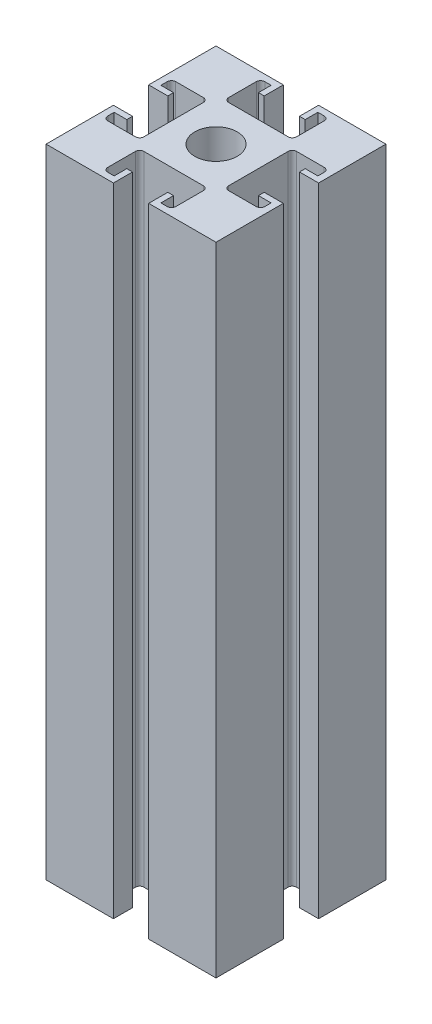
from build123d import *

# Parameters (mm, degrees)
RESSALTO_EXTRUS_O1_DEPTH = 150
ESBO_O2_3_R              = 5
CORTE_EXTRUS_O1_DEPTH    = 10
CORTE_EXTRUS_O2_START    = -20
ESBO_O4_R                = 5
CORTE_EXTRUS_O2_DEPTH    = 20


with BuildPart() as part:
    # Esboço2 → Ressalto-extrusão1 (new body)
    with BuildSketch(Plane(origin=(0, 0, 0), x_dir=(1, 0, 0), z_dir=(0, 1, 0))):
        with BuildLine():
            Line((-1.803730261, 22.417940287), (-1.803730261, 6.567940287))
            Line((-1.803730261, 6.567940287), (2.696269739, 6.567940287))
            Line((2.696269739, 6.567940287), (2.696269739, 7.917940287))
            Line((2.696269739, 7.917940287), (-0.281184469, 7.917940287))
            Line((-0.281184469, 7.917940287), (-0.281184469, 9.417940287))
            ThreePointArc((-0.281184469, 9.417940287), (0.01170875, 10.125047068), (0.718815531, 10.417940287))
            Line((0.718815531, 10.417940287), (7.218815531, 10.417940287))
            ThreePointArc((7.218815531, 10.417940287), (7.925922312, 10.125047068), (8.218815531, 9.417940287))
            Line((8.218815531, 9.417940287), (8.218815531, -4.582059713))
            ThreePointArc((8.218815531, -4.582059713), (7.925922312, -5.289166494), (7.218815531, -5.582059713))
            Line((7.218815531, -5.582059713), (0.718815531, -5.582059713))
            ThreePointArc((0.718815531, -5.582059713), (0.01170875, -5.289166494), (-0.281184469, -4.582059713))
            Line((-0.281184469, -4.582059713), (-0.281184469, -3.082059713))
            Line((-0.281184469, -3.082059713), (2.696269739, -3.082059713))
            Line((2.696269739, -3.082059713), (2.696269739, -1.732059713))
            Line((2.696269739, -1.732059713), (-1.803730261, -1.732059713))
            Line((-1.803730261, -1.732059713), (-1.803730261, -17.582059713))
            Line((-1.803730261, -17.582059713), (14.046269739, -17.582059713))
            Line((14.046269739, -17.582059713), (14.046269739, -13.082059713))
            Line((14.046269739, -13.082059713), (12.696269739, -13.082059713))
            Line((12.696269739, -13.082059713), (12.696269739, -16.059513921))
            Line((12.696269739, -16.059513921), (11.196269739, -16.059513921))
            ThreePointArc((11.196269739, -16.059513921), (10.489162958, -15.766620702), (10.196269739, -15.059513921))
            Line((10.196269739, -15.059513921), (10.196269739, -8.559513921))
            ThreePointArc((10.196269739, -8.559513921), (10.489162958, -7.85240714), (11.196269739, -7.559513921))
            Line((11.196269739, -7.559513921), (25.196269739, -7.559513921))
            ThreePointArc((25.196269739, -7.559513921), (25.90337652, -7.85240714), (26.196269739, -8.559513921))
            Line((26.196269739, -8.559513921), (26.196269739, -15.059513921))
            ThreePointArc((26.196269739, -15.059513921), (25.90337652, -15.766620702), (25.196269739, -16.059513921))
            Line((25.196269739, -16.059513921), (23.696269739, -16.059513921))
            Line((23.696269739, -16.059513921), (23.696269739, -13.082059713))
            Line((23.696269739, -13.082059713), (22.346269739, -13.082059713))
            Line((22.346269739, -13.082059713), (22.346269739, -17.582059713))
            Line((22.346269739, -17.582059713), (38.196269739, -17.582059713))
            Line((38.196269739, -17.582059713), (38.196269739, -1.732059713))
            Line((38.196269739, -1.732059713), (33.696269739, -1.732059713))
            Line((33.696269739, -1.732059713), (33.696269739, -3.082059713))
            Line((33.696269739, -3.082059713), (36.673723947, -3.082059713))
            Line((36.673723947, -3.082059713), (36.673723947, -4.582059713))
            ThreePointArc((36.673723947, -4.582059713), (36.380830728, -5.289166494), (35.673723947, -5.582059713))
            Line((35.673723947, -5.582059713), (29.173723947, -5.582059713))
            ThreePointArc((29.173723947, -5.582059713), (28.466617166, -5.289166494), (28.173723947, -4.582059713))
            Line((28.173723947, -4.582059713), (28.173723947, 9.417940287))
            ThreePointArc((28.173723947, 9.417940287), (28.466617166, 10.125047068), (29.173723947, 10.417940287))
            Line((29.173723947, 10.417940287), (35.673723947, 10.417940287))
            ThreePointArc((35.673723947, 10.417940287), (36.380830728, 10.125047068), (36.673723947, 9.417940287))
            Line((36.673723947, 9.417940287), (36.673723947, 7.917940287))
            Line((36.673723947, 7.917940287), (33.696269739, 7.917940287))
            Line((33.696269739, 7.917940287), (33.696269739, 6.567940287))
            Line((33.696269739, 6.567940287), (38.196269739, 6.567940287))
            Line((38.196269739, 6.567940287), (38.196269739, 22.417940287))
            Line((38.196269739, 22.417940287), (22.346269739, 22.417940287))
            Line((22.346269739, 22.417940287), (22.346269739, 17.917940287))
            Line((22.346269739, 17.917940287), (23.696269739, 17.917940287))
            Line((23.696269739, 17.917940287), (23.696269739, 20.895394495))
            Line((23.696269739, 20.895394495), (25.196269739, 20.895394495))
            ThreePointArc((25.196269739, 20.895394495), (25.90337652, 20.602501277), (26.196269739, 19.895394495))
            Line((26.196269739, 19.895394495), (26.196269739, 13.395394495))
            ThreePointArc((26.196269739, 13.395394495), (25.90337652, 12.688287714), (25.196269739, 12.395394495))
            Line((25.196269739, 12.395394495), (11.196269739, 12.395394495))
            ThreePointArc((11.196269739, 12.395394495), (10.489162958, 12.688287714), (10.196269739, 13.395394495))
            Line((10.196269739, 13.395394495), (10.196269739, 19.895394495))
            ThreePointArc((10.196269739, 19.895394495), (10.489162958, 20.602501277), (11.196269739, 20.895394495))
            Line((11.196269739, 20.895394495), (12.696269739, 20.895394495))
            Line((12.696269739, 20.895394495), (12.696269739, 17.917940287))
            Line((12.696269739, 17.917940287), (14.046269739, 17.917940287))
            Line((14.046269739, 17.917940287), (14.046269739, 22.417940287))
            Line((14.046269739, 22.417940287), (-1.803730261, 22.417940287))
        make_face()
    extrude(amount=RESSALTO_EXTRUS_O1_DEPTH)

    # Esboço2<3> → Corte-extrusão1 (cut)
    with BuildSketch(Plane(origin=(0, 0, 0), x_dir=(1, 0, 0), z_dir=(0, 1, 0))):
        with Locations((18.196269739, 2.417940287)):
            Circle(ESBO_O2_3_R)
    extrude(amount=CORTE_EXTRUS_O1_DEPTH, mode=Mode.SUBTRACT)

    # Esboço4 → Corte-extrusão2 (cut)
    with BuildSketch(Plane(origin=(0, 150, 0), x_dir=(1, 0, 0), z_dir=(0, 1, 0)).offset(CORTE_EXTRUS_O2_START)):
        with Locations((18.196269739, 2.417940287)):
            Circle(ESBO_O4_R)
    extrude(amount=CORTE_EXTRUS_O2_DEPTH, mode=Mode.SUBTRACT)


solid = part.part
